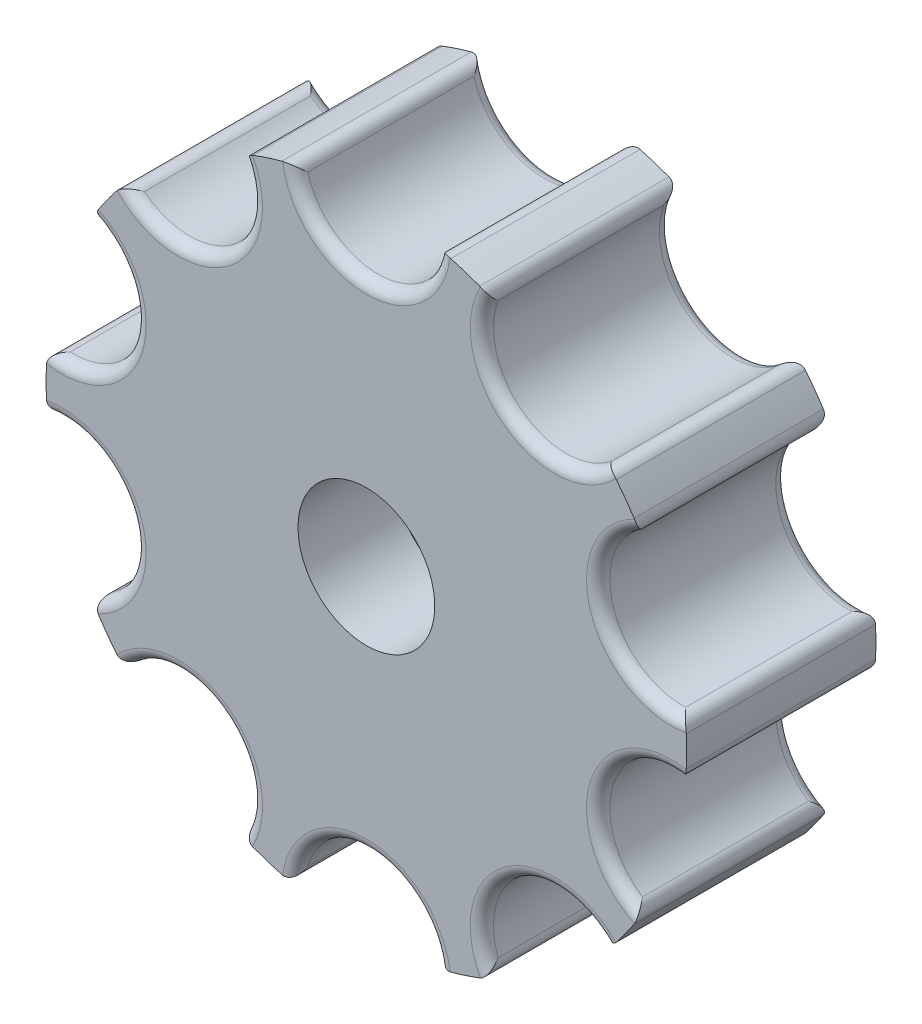
from build123d import *

# Parameters (mm, degrees)
SKETCH1_R           = 11
SKETCH1_R_2         = 2.35
BOSS_EXTRUDE1_DEPTH = 6.5
SKETCH2_R           = 2.5
CUT_EXTRUDE1_DEPTH  = 7.5
FILLET1_R           = 0.4
CUT_EXTRUDE2_DEPTH  = 3.2


with BuildPart() as part:
    # Sketch1 → Boss-Extrude1 (new body)
    with BuildSketch(Plane.XY):
        with Locations(Location((0, 0, 0), (0, 0, 180))):
            Circle(SKETCH1_R)
        with Locations(Location((0, 0, 0), (0, 0, 180))):
            Circle(SKETCH1_R_2, mode=Mode.SUBTRACT)
    extrude(amount=BOSS_EXTRUDE1_DEPTH)

    # Sketch2 → Cut-Extrude1 (cut)
    with BuildSketch(Plane.XY.offset(6.5)):
        with Locations((0, -11)):
            Circle(SKETCH2_R)
        with Locations((-6.465637775, -8.899186938)):
            Circle(SKETCH2_R)
        with Locations((-10.461621679, -3.399186938)):
            Circle(SKETCH2_R)
        with Locations((-10.461621679, 3.399186938)):
            Circle(SKETCH2_R)
        with Locations((-6.465637775, 8.899186938)):
            Circle(SKETCH2_R)
        with Locations((0, 11)):
            Circle(SKETCH2_R)
        with Locations((6.465637775, 8.899186938)):
            Circle(SKETCH2_R)
        with Locations((10.461621679, 3.399186938)):
            Circle(SKETCH2_R)
        with Locations((10.461621679, -3.399186938)):
            Circle(SKETCH2_R)
        with Locations((6.465637775, -8.899186938)):
            Circle(SKETCH2_R)
    extrude(amount=-CUT_EXTRUDE1_DEPTH, mode=Mode.SUBTRACT)

    # Fillet1
    fillet1_edges = [part.edges().sort_by_distance(p)[0] for p in [
        (2.483806022, -10.715909091, 3.25),
        (-2.483806022, -10.715909091, 3.25),
        (0, -8.5, 0),
        (0, -8.5, 6.5),
        (-10.95897344, 0.949158117, 3.25),
        (-9.423896897, 5.673637922, 3.25),
        (-9.423896897, -5.673637922, 3.25),
        (-10.95897344, -0.949158117, 3.25),
        (-4.289212046, -10.129297114, 3.25),
        (-8.308094611, -7.209408015, 3.25),
        (4.289212046, 10.129297114, 3.25),
        (8.308094611, 7.209408015, 3.25),
        (-8.308094611, 7.209408015, 3.25),
        (-4.289212046, 10.129297114, 3.25),
        (-2.483806022, 10.715909091, 3.25),
        (2.483806022, 10.715909091, 3.25),
        (9.423896897, 5.673637922, 3.25),
        (10.95897344, 0.949158117, 3.25),
        (10.95897344, -0.949158117, 3.25),
        (9.423896897, -5.673637922, 3.25),
        (8.308094611, -7.209408015, 3.25),
        (4.289212046, -10.129297114, 3.25),
        (4.996174644, -6.876644452, 0),
        (4.996174644, -6.876644452, 6.5),
        (8.083980389, -2.626644452, 0),
        (8.083980389, -2.626644452, 6.5),
        (8.083980389, 2.626644452, 0),
        (8.083980389, 2.626644452, 6.5),
        (0, 8.5, 0),
        (0, 8.5, 6.5),
        (-4.996174644, 6.876644452, 0),
        (-4.996174644, 6.876644452, 6.5),
        (4.996174644, 6.876644452, 0),
        (4.996174644, 6.876644452, 6.5),
        (-4.996174644, -6.876644452, 0),
        (-4.996174644, -6.876644452, 6.5),
        (-8.083980389, -2.626644452, 0),
        (-8.083980389, -2.626644452, 6.5),
        (-8.083980389, 2.626644452, 0),
        (-8.083980389, 2.626644452, 6.5),
    ]]
    fillet(fillet1_edges, radius=FILLET1_R)

    # Sketch3 → Cut-Extrude2 (cut)
    with BuildSketch(Plane(origin=(0, 0, 0), x_dir=(-1, 0, 0), z_dir=(0, 0, -1))):
        Polygon((4.330127019, 0), (2.165063509, 3.75), (-2.165063509, 3.75), (-4.330127019, 0), (-2.165063509, -3.75), (2.165063509, -3.75), align=None)
    extrude(amount=-CUT_EXTRUDE2_DEPTH, mode=Mode.SUBTRACT)


solid = part.part
